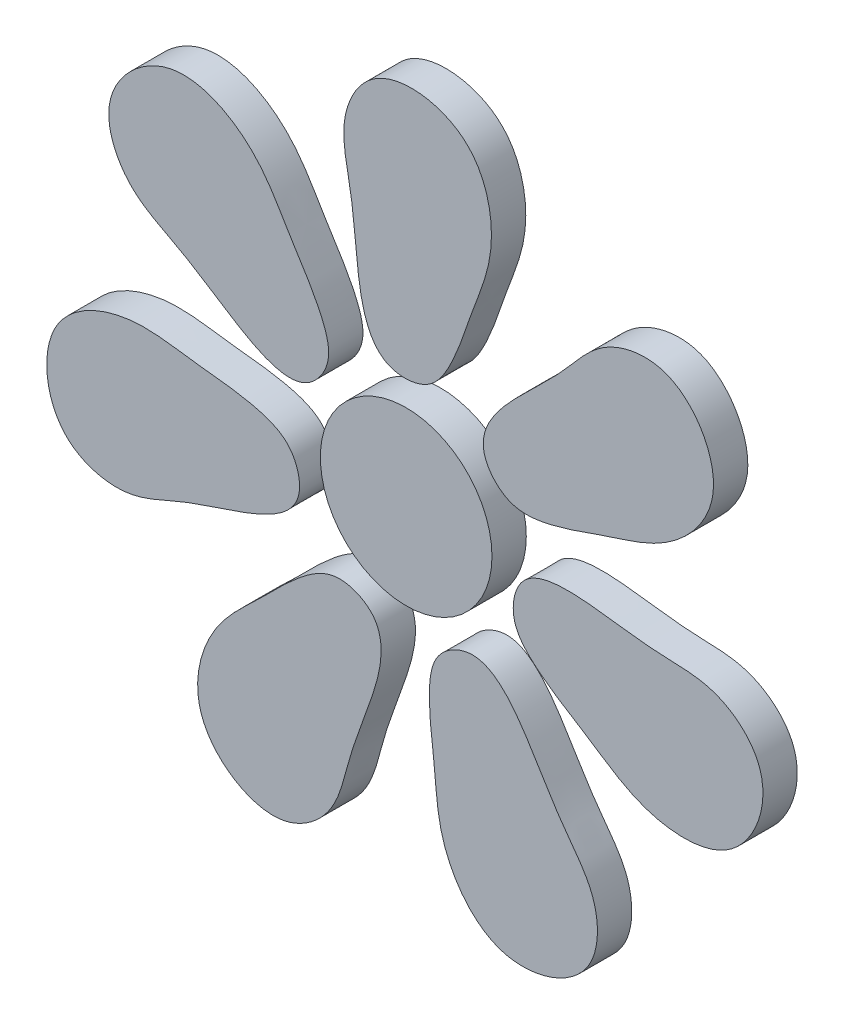
from build123d import *

# Parameters (mm, degrees)
SKETCH_1_R        = 7.5
EXTRUDE_1_DEPTH   = 3
EXTRUDE_2_DEPTH   = 3
EXTRUDE_2_2_DEPTH = 3
EXTRUDE_2_3_DEPTH = 3
EXTRUDE_2_4_DEPTH = 3
EXTRUDE_2_5_DEPTH = 3
EXTRUDE_2_6_DEPTH = 3
EXTRUDE_2_7_DEPTH = 3


with BuildPart() as part:
    # Эскиз1 → Бобышка-Вытянуть1 (new body)
    with BuildSketch(Plane.XY):
        Circle(SKETCH_1_R)
    extrude(amount=EXTRUDE_1_DEPTH)


with BuildPart() as body_2:
    # Эскиз2 → Бобышка-Вытянуть2 (new body)
    with BuildSketch(Plane.XY):
        with BuildLine():
            add(Edge.make_bspline(
                [(-1.502112327, 9.949912266), (-3.461450161, 10.785411336), (-4.371231961, 15.996564274), (-4.657900563, 21.256016574), (-6.059343405, 26.550798593), (-2.864155939, 32.796176063), (6.583594841, 31.586606932), (8.121164745, 23.314744258), (5.636720749, 17.609436863), (4.347946989, 13.195089565), (2.038541561, 9.662437351), (-0.539712999, 9.539526814), (-1.502112327, 9.949912266)],
                knots=[0, 0, 0, 0, 0.119420768, 0.222513462, 0.30680726, 0.40680398, 0.54683774, 0.690236949, 0.784949618, 0.885194629, 0.94134219, 1, 1, 1, 1], degree=3))
        make_face()
    extrude(amount=EXTRUDE_2_DEPTH)


with BuildPart() as body_3:
    # Эскиз2 → Extrude 2 2 (new body)
    with BuildSketch(Plane.XY):
        with BuildLine():
            add(Edge.make_bspline(
                [(6.842602941, 7.378067535), (6.274195259, 9.430864688), (9.781199011, 13.391261454), (13.71446945, 16.894602865), (16.980311406, 21.291537591), (23.855310932, 22.687368598), (28.800207967, 14.546665583), (23.291664464, 8.187123006), (17.282050031, 6.572338561), (13.027237042, 4.827641938), (8.825407592, 4.430635179), (7.121796841, 6.369762297), (6.842602941, 7.378067535)],
                knots=[0, 0, 0, 0, 0.119420768, 0.222513462, 0.30680726, 0.40680398, 0.54683774, 0.690236949, 0.784949618, 0.885194629, 0.94134219, 1, 1, 1, 1], degree=3))
        make_face()
    extrude(amount=EXTRUDE_2_2_DEPTH)


with BuildPart() as body_4:
    # Эскиз2 → Extrude 2 3 (new body)
    with BuildSketch(Plane.XY):
        with BuildLine():
            add(Edge.make_bspline(
                [(10.03469863, -0.749612536), (11.285243678, 0.974684575), (16.568187628, 0.702065627), (21.759564244, -0.188791389), (27.233445393, -0.000685486), (32.611242111, -4.505490158), (29.329677076, -13.447211648), (20.923065778, -13.105568856), (15.91364315, -9.413864729), (11.896751896, -7.175118534), (8.966561701, -4.137525652), (9.420448401, -1.596563149), (10.03469863, -0.749612536)],
                knots=[0, 0, 0, 0, 0.119420768, 0.222513462, 0.30680726, 0.40680398, 0.54683774, 0.690236949, 0.784949618, 0.885194629, 0.94134219, 1, 1, 1, 1], degree=3))
        make_face()
    extrude(amount=EXTRUDE_2_3_DEPTH)


with BuildPart() as body_5:
    # Эскиз2 → Extrude 2 4 (new body)
    with BuildSketch(Plane.XY):
        with BuildLine():
            add(Edge.make_bspline(
                [(5.67046158, -8.312819077), (7.798273431, -8.215452902), (10.878993031, -12.515799936), (13.419263347, -17.130021876), (16.979239538, -21.292392378), (16.810242832, -28.305622931), (7.773301131, -31.315064235), (2.798971809, -24.529500065), (2.561938398, -18.31123587), (1.807769922, -13.774868404), (2.355711964, -9.590045276), (4.625310173, -8.36064398), (5.67046158, -8.312819077)],
                knots=[0, 0, 0, 0, 0.119420768, 0.222513462, 0.30680726, 0.40680398, 0.54683774, 0.690236949, 0.784949618, 0.885194629, 0.94134219, 1, 1, 1, 1], degree=3))
        make_face()
    extrude(amount=EXTRUDE_2_4_DEPTH)


with BuildPart() as body_6:
    # Эскиз2 → Extrude 2 5 (new body)
    with BuildSketch(Plane.XY):
        with BuildLine():
            add(Edge.make_bspline(
                [(-2.963748696, -9.616303303), (-1.560955765, -11.21918678), (-3.002305209, -16.309012872), (-5.026016553, -21.171996502), (-6.060680003, -26.550493524), (-11.649212165, -30.791044307), (-19.636529112, -25.602034742), (-17.432805021, -17.482217414), (-12.718958222, -13.41987292), (-9.642499675, -10.00186141), (-6.029036929, -7.821065206), (-3.652780954, -8.828989368), (-2.963748696, -9.616303303)],
                knots=[0, 0, 0, 0, 0.119420768, 0.222513462, 0.30680726, 0.40680398, 0.54683774, 0.690236949, 0.784949618, 0.885194629, 0.94134219, 1, 1, 1, 1], degree=3))
        make_face()
    extrude(amount=EXTRUDE_2_5_DEPTH)


with BuildPart() as body_7:
    # Эскиз2 → Extrude 2 6 (new body)
    with BuildSketch(Plane.XY):
        with BuildLine():
            add(Edge.make_bspline(
                [(-9.366195754, -3.678515005), (-9.744753433, -5.774644182), (-14.622806391, -7.821206472), (-19.686603476, -9.271025932), (-24.536783886, -11.815531515), (-31.336572802, -10.090181297), (-32.259652422, -0.610150902), (-24.537324106, 2.729531522), (-18.422219881, 1.576928054), (-13.831770345, 1.302751227), (-9.873798045, -0.162663516), (-9.18025352, -2.648925683), (-9.366195754, -3.678515005)],
                knots=[0, 0, 0, 0, 0.119420768, 0.222513462, 0.30680726, 0.40680398, 0.54683774, 0.690236949, 0.784949618, 0.885194629, 0.94134219, 1, 1, 1, 1], degree=3))
        make_face()
    extrude(amount=EXTRUDE_2_6_DEPTH)


with BuildPart() as body_8:
    # Эскиз2 → Extrude 2 7 (new body)
    with BuildSketch(Plane.XY):
        with BuildLine():
            add(Edge.make_bspline(
                [(-8.715706375, 5.02927012), (-10.590553009, 4.018323266), (-15.23203611, 6.556127925), (-19.522776449, 9.611216259), (-24.536189044, 11.816766717), (-27.426854969, 18.208794031), (-20.590599481, 24.841189012), (-13.164737669, 20.88588755), (-10.253174225, 15.38627004), (-7.605435829, 11.626365618), (-6.283387844, 7.61822712), (-7.794807942, 5.525833069), (-8.715706375, 5.02927012)],
                knots=[0, 0, 0, 0, 0.119420768, 0.222513462, 0.30680726, 0.40680398, 0.54683774, 0.690236949, 0.784949618, 0.885194629, 0.94134219, 1, 1, 1, 1], degree=3))
        make_face()
    extrude(amount=EXTRUDE_2_7_DEPTH)


solid = Compound([part.part, body_2.part, body_3.part, body_4.part, body_5.part, body_6.part, body_7.part, body_8.part])
